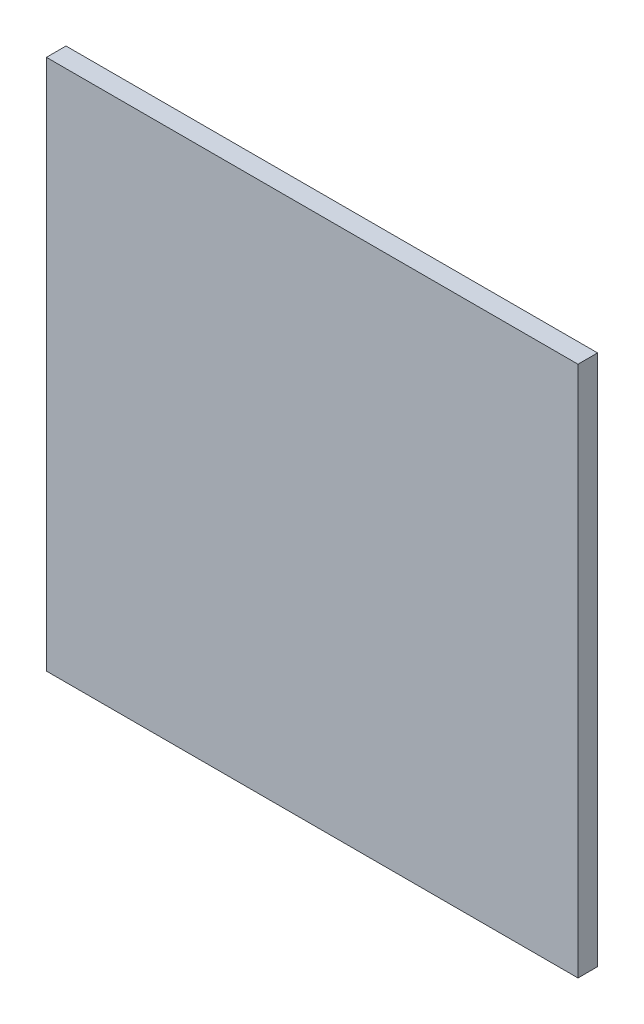
from build123d import *

# Parameters (mm, degrees)
SKETCH_1_W      = 27.139113671
SKETCH_1_H      = 27.13911367
EXTRUDE_1_DEPTH = 1


with BuildPart() as part:
    # 草图1 → 凸台-拉伸1 (new body)
    with BuildSketch(Plane(origin=(0, 0, 0.17779991), x_dir=(-1, 0, 0), z_dir=(0, 0, -1))):
        with Locations((-18.808700085, 17.120299825)):
            Rectangle(SKETCH_1_W, SKETCH_1_H)
    extrude(amount=EXTRUDE_1_DEPTH)


solid = part.part
